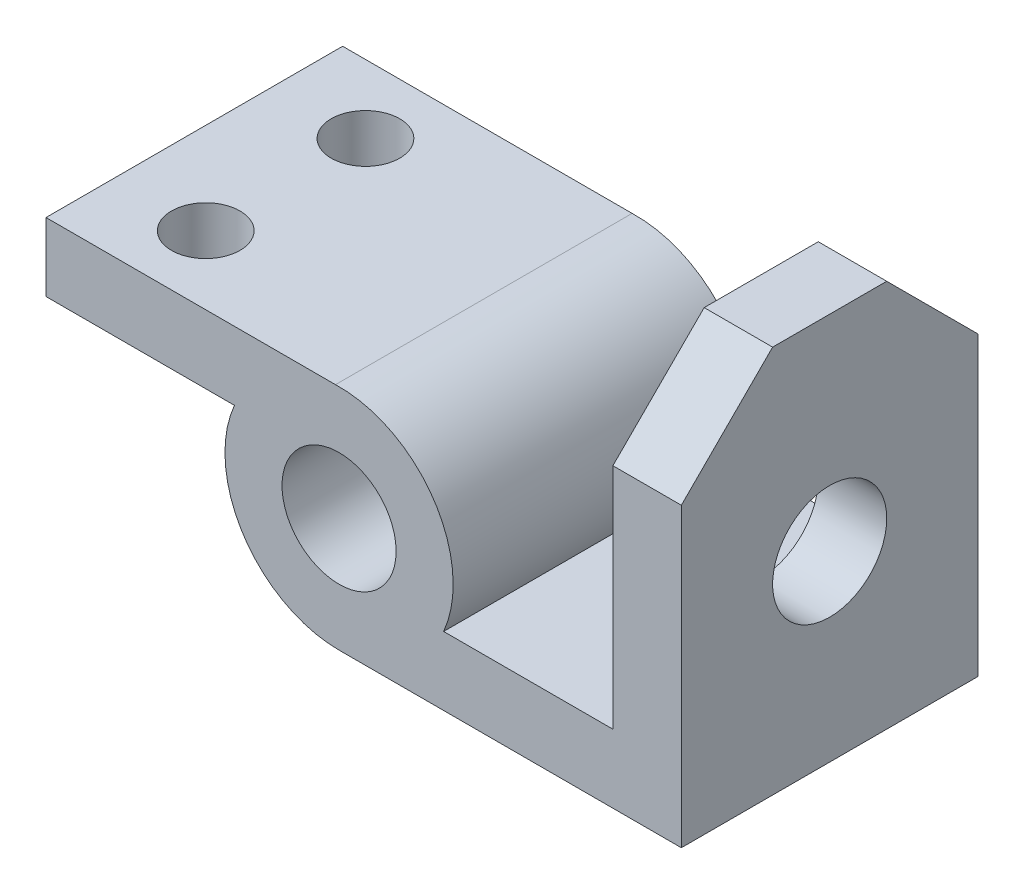
from build123d import *

# Parameters (mm, degrees)
SKETCH1_R           = 31.75
SKETCH1_R_2         = 15.875
BOSS_EXTRUDE1_DEPTH = 82.55
BOSS_EXTRUDE2_DEPTH = 82.55
SKETCH4_R           = 9.525
CUT_EXTRUDE1_DEPTH  = 82.55
SKETCH5_W           = 19.05
SKETCH5_H           = 82.55
BOSS_EXTRUDE3_DEPTH = 88.9
CHAMFER1_SIZE       = 25.4
CUT_EXTRUDE2_REACH  = 211.476
SKETCH6_R           = 15.875


with BuildPart() as part:
    # Sketch1 → Boss-Extrude1 (new body)
    with BuildSketch(Plane.XY):
        Circle(SKETCH1_R)
        Circle(SKETCH1_R_2, mode=Mode.SUBTRACT)
    extrude(amount=-BOSS_EXTRUDE1_DEPTH)

    # Sketch3 → Boss-Extrude2 (add)
    with BuildSketch(Plane.XY):
        Polygon((0.997093544, 31.734339515), (-81.552906456, 31.734339515), (-81.552906456, 12.684339515), (-29.106185443, 12.684339515), align=None)
        Polygon((0, -31.75), (95.25, -31.75), (95.25, -12.7), (29.099355663, -12.7), align=None)
    extrude(amount=-BOSS_EXTRUDE2_DEPTH)

    # Sketch4 → Cut-Extrude1 (cut)
    with BuildSketch(Plane(origin=(0, 31.734339515, 0), x_dir=(1, 0, 0), z_dir=(0, 1, 0))):
        with Locations(Location((-56.152906456, 63.5, 0), (0, 0, 180))):
            Circle(SKETCH4_R)
        with Locations(Location((-56.152906456, 19.05, 0), (0, 0, 180))):
            Circle(SKETCH4_R)
    extrude(amount=-CUT_EXTRUDE1_DEPTH, mode=Mode.SUBTRACT)

    # Sketch5 → Boss-Extrude3 (add)
    with BuildSketch(Plane(origin=(0, -12.7, 0), x_dir=(1, 0, 0), z_dir=(0, 1, 0))):
        with Locations((85.725, 41.275)):
            Rectangle(SKETCH5_W, SKETCH5_H)
    extrude(amount=BOSS_EXTRUDE3_DEPTH)

    # Chamfer1
    chamfer1_edges = [part.edges().sort_by_distance(p)[0] for p in [
        (85.725, 76.2, -82.55),
        (85.725, 76.2, 0),
    ]]
    chamfer(chamfer1_edges, length=CHAMFER1_SIZE)

    # Sketch6 → Cut-Extrude2 (cut, up to next)
    with BuildSketch(Plane(origin=(95.25, 0, 0), x_dir=(0, 0, -1), z_dir=(1, 0, 0)), mode=Mode.PRIVATE) as cut_extrude2_sk1:
        with Locations((41.275, 19.05)):
            Circle(SKETCH6_R)
    cut_extrude2_tool1 = extrude(cut_extrude2_sk1.sketch, amount=-CUT_EXTRUDE2_REACH, mode=Mode.PRIVATE) & part.part
    add(cut_extrude2_tool1.solids().sort_by_distance((95.25, 19.05, -41.275))[0], mode=Mode.SUBTRACT)


solid = part.part
